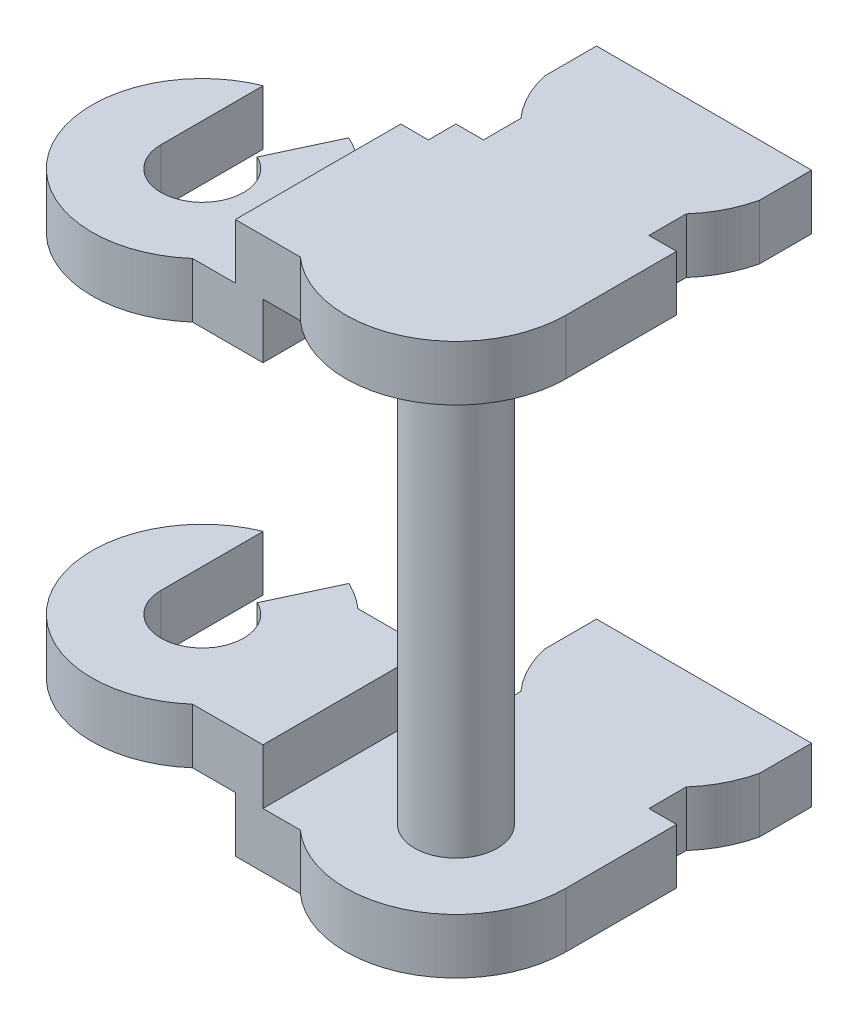
from build123d import *

# Parameters (mm, degrees)
EXTRUDE_1_DEPTH      = 4
EXTRUDE_1_DEPTH_BACK = 4
SKETCH_1_R           = 0.75
SKETCH_2_R           = 2
EXTRUDE_2_DEPTH      = 1
EXTRUDE_START        = 1
SKETCH_3_R           = 2
EXTRUDE_3_DEPTH      = 1
SKETCH_6_W           = 1.5
SKETCH_6_H           = 3
EXTRUDE_6_DEPTH      = 1
SKETCH_7_W           = 1.5
SKETCH_7_H           = 3
EXTRUDE_8_DEPTH      = 1
SKETCH_8_W           = 3
SKETCH_8_H           = 2
EXTRUDE_9_DEPTH      = 0.5
EXTRUDE_10_DEPTH     = 1
EXTRUDE_START_2      = 7
EXTRUDE_11_DEPTH     = 1
CUT_EXTRUDE_1_DEPTH  = 12.338430226
EXTRUDE_12_DEPTH     = 1


with BuildPart() as part:
    # 草图1 → 凸台-拉伸1 (new, two sides: drawn at the far end of the back side and taken through both)
    with BuildSketch(Plane(origin=(0, 0, 0), x_dir=(1, 0, 0), z_dir=(0, 1, 0)).offset(-EXTRUDE_1_DEPTH_BACK)):
        with Locations(Location((0, 0, 0), (0, 0, 270))):
            Circle(SKETCH_1_R)
    extrude(amount=EXTRUDE_1_DEPTH + EXTRUDE_1_DEPTH_BACK)

    # 草图2 → 凸台-拉伸2 (add)
    with BuildSketch(Plane(origin=(0, 4, 0), x_dir=(-1, 0, 0), z_dir=(0, 1, 0))):
        with Locations(Location((0, 0, 0), (0, 0, 90))):
            Circle(SKETCH_2_R)
    extrude(amount=EXTRUDE_2_DEPTH)

    # 草图3 → 凸台-拉伸3 (add)
    with BuildSketch(Plane.XZ.offset(4).offset(EXTRUDE_START)):
        with Locations(Location((0, 0, 0), (0, 0, 90))):
            Circle(SKETCH_3_R)
    extrude(amount=-EXTRUDE_3_DEPTH)

    # 草图6 → 凸台-拉伸6 (add)
    with BuildSketch(Plane(origin=(0, 5, 0), x_dir=(-1, 0, 0), z_dir=(0, 1, 0))):
        with Locations((1.75, 0)):
            Rectangle(SKETCH_6_W, SKETCH_6_H)
    extrude(amount=-EXTRUDE_6_DEPTH)

    # 草图7 → 凸台-拉伸8 (add)
    with BuildSketch(Plane.XZ.offset(5)):
        with Locations((-1.75, 0)):
            Rectangle(SKETCH_7_W, SKETCH_7_H)
    extrude(amount=-EXTRUDE_8_DEPTH)

    # 草图8 → 凸台-拉伸9 (add)
    with BuildSketch(Plane.ZY.offset(2.5)):
        with Locations((0, 4)):
            Rectangle(SKETCH_8_W, SKETCH_8_H)
        with Locations((0, -4)):
            Rectangle(SKETCH_8_W, SKETCH_8_H)
    extrude(amount=-EXTRUDE_9_DEPTH)

    # 草图9 → 凸台-拉伸10 (add)
    with BuildSketch(Plane.XZ.offset(-3)):
        with BuildLine():
            Line((-2.5, -1.5), (-3.277124344, -1.5))
            ThreePointArc((-3.277124344, -1.5), (-6.6, 0), (-3.277124344, 1.5))
            Line((-3.277124344, 1.5), (-2.5, 1.5))
            Line((-2.5, 1.5), (-2.5, -1.5))
        make_face()
    extrude(amount=-EXTRUDE_10_DEPTH)

    # 草图9<2> → 凸台-拉伸11 (add)
    with BuildSketch(Plane.XZ.offset(-3).offset(EXTRUDE_START_2)):
        with BuildLine():
            Line((-2.5, -1.5), (-3.277124344, -1.5))
            ThreePointArc((-3.277124344, -1.5), (-6.6, 0), (-3.277124344, 1.5))
            Line((-3.277124344, 1.5), (-2.5, 1.5))
            Line((-2.5, 1.5), (-2.5, -1.5))
        make_face()
    extrude(amount=-EXTRUDE_11_DEPTH)

    # 草图10 → 切除-拉伸1 (cut, through all)
    with BuildSketch(Plane(origin=(0, 4, 0), x_dir=(-1, 0, 0), z_dir=(0, 1, 0))):
        with BuildLine():
            Line((5.35, 0), (5.35, -1.854049622))
            ThreePointArc((5.35, -1.854049622), (4.548070298, -1.999325713), (3.754763477, -1.812615574))
            Line((3.754763477, -1.812615574), (4.283036304, -0.67973084))
            ThreePointArc((4.283036304, -0.67973084), (4.197025294, 0.632543584), (5.35, 0))
        make_face()
    extrude(amount=-CUT_EXTRUDE_1_DEPTH, mode=Mode.SUBTRACT)

    # 草图11 → 凸台-拉伸12 (add)
    with BuildSketch(Plane(origin=(0, 5, 0), x_dir=(1, 0, 0), z_dir=(0, 1, 0))):
        with BuildLine():
            Line((-2, 0), (2, 0))
            Line((2, 0), (2, 2))
            Line((2, 2), (1.5, 2))
            Line((1.5, 2), (1.5, 2.677124344))
            ThreePointArc((1.5, 2.677124344), (1.780042303, 3.088161527), (1.95, 3.555590279))
            Line((1.95, 3.555590279), (1.95, 4.5))
            Line((1.95, 4.5), (-1.95, 4.5))
            Line((-1.95, 4.5), (-1.95, 3.555590279))
            ThreePointArc((-1.95, 3.555590279), (-1.780042303, 3.088161527), (-1.5, 2.677124344))
            Line((-1.5, 2.677124344), (-1.5, 2))
            Line((-1.5, 2), (-2, 2))
            Line((-2, 2), (-2, 0))
        make_face()
    extrude_12 = extrude(amount=-EXTRUDE_12_DEPTH)

    # 镜向1: 凸台-拉伸12 across plane
    add(extrude_12.mirror(Plane.ZX))


solid = part.part
